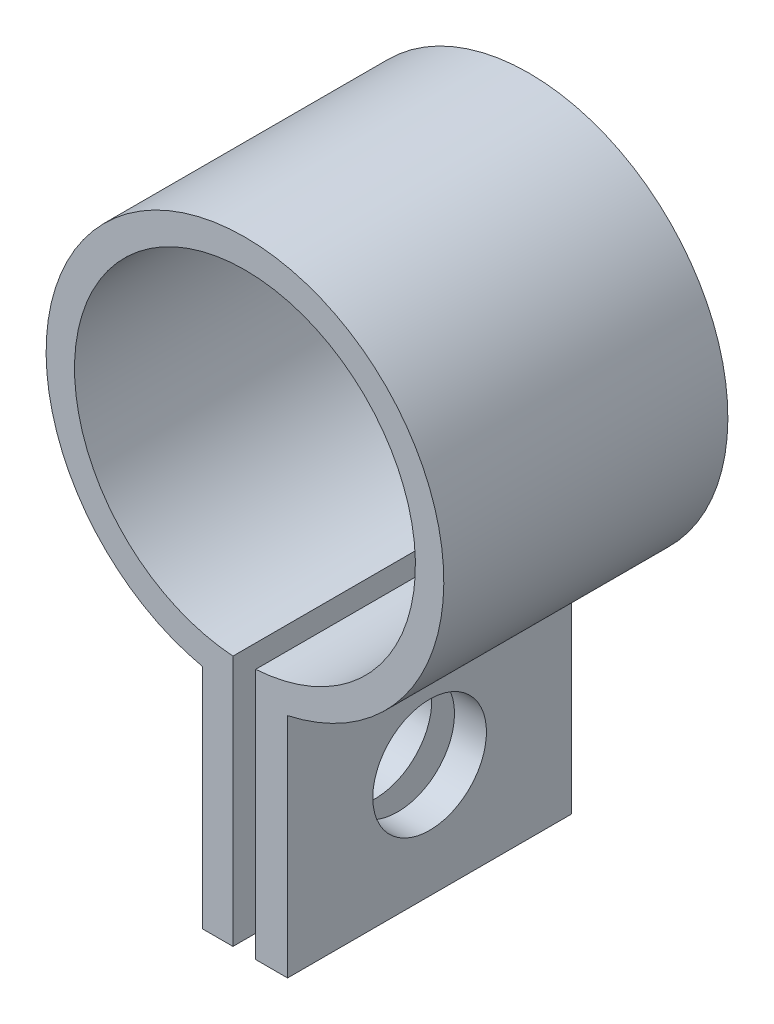
from build123d import *

# Parameters (mm, degrees)
SKETCH1_R                 = 6
BOSS_EXTRUDE1_DEPTH       = 5
SKETCH2_W                 = 0.799850041
SKETCH2_H                 = 15.18552409
CUT_EXTRUDE1_DEPTH        = 20.213233842
F_4_0MM_DOWEL_HOLE1_D     = 4
F_4_0MM_DOWEL_HOLE1_DEPTH = 32.5
F_4_0MM_DOWEL_HOLE1_TIP   = 1.201721238


with BuildPart() as part:
    # Sketch1 → Boss-Extrude1 (new, symmetric)
    with BuildSketch(Plane.XY):
        with BuildLine():
            Line((1.5, -14.837397166), (-1.5, -14.837397166))
            Line((-1.5, -14.837397166), (-1.5, -6.837397166))
            ThreePointArc((-1.5, -6.837397166), (0, 7), (1.5, -6.837397166))
            Line((1.5, -6.837397166), (1.5, -14.837397166))
        make_face()
        Circle(SKETCH1_R, mode=Mode.SUBTRACT)
    extrude(amount=BOSS_EXTRUDE1_DEPTH, both=True)

    # Sketch2 → Cut-Extrude1 (cut, through all)
    with BuildSketch(Plane.XY.offset(5)):
        with Locations((-0.023277633, -7.592762045)):
            Rectangle(SKETCH2_W, SKETCH2_H)
    extrude(amount=-CUT_EXTRUDE1_DEPTH, mode=Mode.SUBTRACT)

    # Ø4.0mm Dowel Hole1
    with Locations(Plane.ZY.offset(1.5)):
        with Locations((0, -10.837397166)):
            Hole(F_4_0MM_DOWEL_HOLE1_D / 2, depth=F_4_0MM_DOWEL_HOLE1_DEPTH)
            with Locations((0, 0, -(F_4_0MM_DOWEL_HOLE1_DEPTH + F_4_0MM_DOWEL_HOLE1_TIP / 2))):  # 118° drill point
                Cone(0, F_4_0MM_DOWEL_HOLE1_D / 2, F_4_0MM_DOWEL_HOLE1_TIP, mode=Mode.SUBTRACT)


solid = part.part
